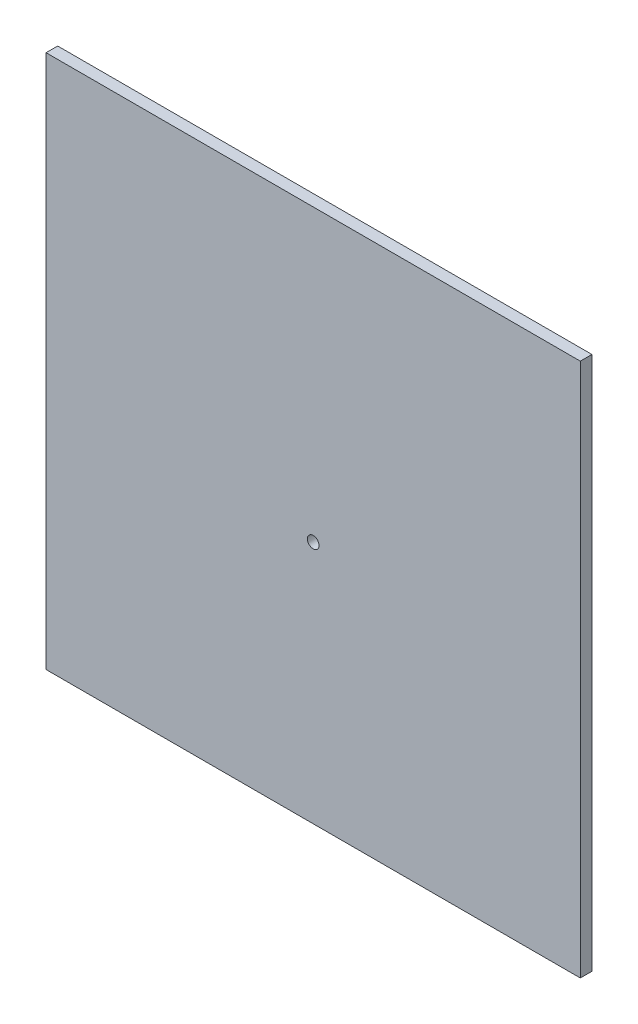
from build123d import *

# Parameters (mm, degrees)
SKETCH1_W           = 584.2
SKETCH1_H           = 584.2
SKETCH1_R           = 6.35
BOSS_EXTRUDE1_DEPTH = 12.7


with BuildPart() as part:
    # Sketch1 → Boss-Extrude1 (new body)
    with BuildSketch(Plane.XY):
        with Locations((292.1, 292.1)):
            Rectangle(SKETCH1_W, SKETCH1_H)
        with Locations((292.1, 266.7)):
            Circle(SKETCH1_R, mode=Mode.SUBTRACT)
    extrude(amount=BOSS_EXTRUDE1_DEPTH)


solid = part.part
